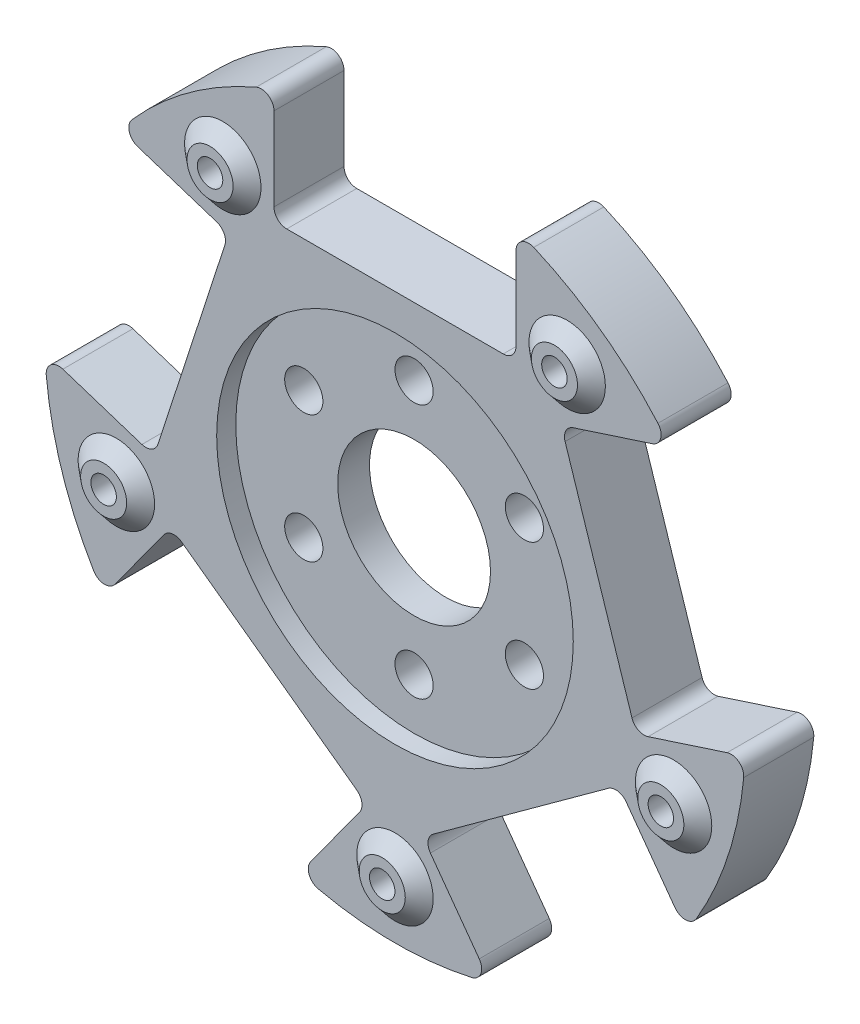
from build123d import *

# Parameters (mm, degrees)
SKETCH2_R                     = 14
BOSS_EXTRUDE1_DEPTH           = 2.75
SKETCH2_3_R                   = 14
SKETCH2_3_R_2                 = 1.5
SKETCH2_3_R_3                 = 6
BOSS_EXTRUDE2_DEPTH           = 1.25
FILLET1_R                     = 1
SKETCH3_R                     = 3
BOSS_EXTRUDE3_DEPTH           = 1
BOSS_EXTRUDE3_DRAFT           = 50
BOSS_EXTRUDE3_PROFILE_2_DEPTH = 1
BOSS_EXTRUDE3_PROFILE_2_DRAFT = 50
BOSS_EXTRUDE3_PROFILE_3_DEPTH = 1
BOSS_EXTRUDE3_PROFILE_3_DRAFT = 50
BOSS_EXTRUDE3_PROFILE_4_DEPTH = 1
BOSS_EXTRUDE3_PROFILE_4_DRAFT = 50
BOSS_EXTRUDE3_PROFILE_5_DEPTH = 1
BOSS_EXTRUDE3_PROFILE_5_DRAFT = 50
SKETCH4_R                     = 1
CUT_EXTRUDE1_DEPTH            = 2
SKETCH5_R                     = 3
BOSS_EXTRUDE5_DEPTH           = 1
BOSS_EXTRUDE5_DRAFT           = 50
BOSS_EXTRUDE5_PROFILE_2_DEPTH = 1
BOSS_EXTRUDE5_PROFILE_2_DRAFT = 50
BOSS_EXTRUDE5_PROFILE_3_DEPTH = 1
BOSS_EXTRUDE5_PROFILE_3_DRAFT = 50
BOSS_EXTRUDE5_PROFILE_4_DEPTH = 1
BOSS_EXTRUDE5_PROFILE_4_DRAFT = 50
BOSS_EXTRUDE5_PROFILE_5_DEPTH = 1
BOSS_EXTRUDE5_PROFILE_5_DRAFT = 50
CUT_EXTRUDE2_START            = -1
SKETCH6_R                     = 1
CUT_EXTRUDE2_DEPTH            = 1


with BuildPart() as part:
    # Sketch2 → Boss-Extrude1 (new, symmetric)
    with BuildSketch(Plane.XY):
        with BuildLine():
            Line((-9.5, 16.806975801), (-9.5, 25.806975801))
            ThreePointArc((-9.5, 25.806975801), (-16.164094438, 22.247967345), (-21.608231055, 17.009831001))
            Line((-21.608231055, 17.009831001), (-13.048722408, 14.228678051))
            Line((-13.048722408, 14.228678051), (-18.920045301, -3.841395758))
            Line((-18.920045301, -3.841395758), (-27.479553948, -1.060242809))
            ThreePointArc((-27.479553948, -1.060242809), (-26.154054198, -8.497967345), (-22.854621229, -15.2943221))
            Line((-22.854621229, -15.2943221), (-17.564553958, -8.01316915))
            Line((-17.564553958, -8.01316915), (-2.193231065, -19.181088944))
            Line((-2.193231065, -19.181088944), (-7.483298336, -26.462241893))
            ThreePointArc((-7.483298336, -26.462241893), (0, -27.5), (7.483298336, -26.462241893))
            Line((7.483298336, -26.462241893), (2.193231065, -19.181088944))
            Line((2.193231065, -19.181088944), (17.564553958, -8.01316915))
            Line((17.564553958, -8.01316915), (22.854621229, -15.2943221))
            ThreePointArc((22.854621229, -15.2943221), (26.154054198, -8.497967345), (27.479553948, -1.060242809))
            Line((27.479553948, -1.060242809), (18.920045301, -3.841395758))
            Line((18.920045301, -3.841395758), (13.048722408, 14.228678051))
            Line((13.048722408, 14.228678051), (21.608231055, 17.009831001))
            ThreePointArc((21.608231055, 17.009831001), (16.164094438, 22.247967345), (9.5, 25.806975801))
            Line((9.5, 25.806975801), (9.5, 16.806975801))
            Line((9.5, 16.806975801), (-9.5, 16.806975801))
        make_face()
        Circle(SKETCH2_R, mode=Mode.SUBTRACT)
    extrude(amount=BOSS_EXTRUDE1_DEPTH, both=True)

    # Sketch2<3> → Boss-Extrude2 (add, symmetric)
    with BuildSketch(Plane.XY):
        Circle(SKETCH2_3_R)
        with Locations((0, -10)):
            Circle(SKETCH2_3_R_2, mode=Mode.SUBTRACT)
        with Locations((-8.660254038, -5)):
            Circle(SKETCH2_3_R_2, mode=Mode.SUBTRACT)
        with Locations((8.660254038, -5)):
            Circle(SKETCH2_3_R_2, mode=Mode.SUBTRACT)
        with Locations((-8.660254038, 5)):
            Circle(SKETCH2_3_R_2, mode=Mode.SUBTRACT)
        Circle(SKETCH2_3_R_3, mode=Mode.SUBTRACT)
        with Locations((8.660254038, 5)):
            Circle(SKETCH2_3_R_2, mode=Mode.SUBTRACT)
        with Locations((0, 10)):
            Circle(SKETCH2_3_R_2, mode=Mode.SUBTRACT)
    extrude(amount=BOSS_EXTRUDE2_DEPTH, both=True)

    # Fillet1
    fillet1_edges = [part.edges().sort_by_distance(p)[0] for p in [
        (-18.920045301, -3.841395758, 0),
        (-13.048722408, 14.228678051, 0),
        (-21.608231055, 17.009831001, 0),
        (-9.5, 25.806975801, 0),
        (-9.5, 16.806975801, 0),
        (9.5, 16.806975801, 0),
        (9.5, 25.806975801, 0),
        (21.608231055, 17.009831001, 0),
        (13.048722408, 14.228678051, 0),
        (18.920045301, -3.841395758, 0),
        (27.479553948, -1.060242809, 0),
        (22.854621229, -15.2943221, 0),
        (17.564553958, -8.01316915, 0),
        (2.193231065, -19.181088944, 0),
        (7.483298336, -26.462241893, 0),
        (-7.483298336, -26.462241893, 0),
        (-2.193231065, -19.181088944, 0),
        (-17.564553958, -8.01316915, 0),
        (-22.854621229, -15.2943221, 0),
        (-27.479553948, -1.060242809, 0),
    ]]
    fillet(fillet1_edges, radius=FILLET1_R)


with BuildPart() as boss_extrude3_tool:
    # Sketch3 → Boss-Extrude3 (with draft: the straight prism first)
    with BuildSketch(Plane.XY.offset(2.75)):
        with Locations((13.519060803, 18.607390871)):
            Circle(SKETCH3_R)
    extrude(amount=BOSS_EXTRUDE3_DEPTH)
    # Boss-Extrude3: the draft: its side faces are tilted about the plane it starts from
    boss_extrude3_sides = [boss_extrude3_tool.faces().sort_by_distance(p)[0] for p in [
        (10.519060803, 18.607390871, 3.25),
    ]]
    draft(boss_extrude3_sides, Plane.XY.offset(2.75), BOSS_EXTRUDE3_DRAFT)


with BuildPart() as part_1:
    add(part.part)

    # Boss-Extrude3: add boss_extrude3_tool
    add(boss_extrude3_tool.part)


with BuildPart() as boss_extrude3_profile_2_tool:
    # Sketch3 → Boss-Extrude3 profile 2 (with draft: the straight prism first)
    with BuildSketch(Plane.XY.offset(2.75)):
        with Locations((21.874299875, -7.107390871)):
            Circle(SKETCH3_R)
    extrude(amount=BOSS_EXTRUDE3_PROFILE_2_DEPTH)
    # Boss-Extrude3 profile 2: the draft: its side faces are tilted about the plane it starts from
    boss_extrude3_profile_2_sides = [boss_extrude3_profile_2_tool.faces().sort_by_distance(p)[0] for p in [
        (18.874299875, -7.107390871, 3.25),
    ]]
    draft(boss_extrude3_profile_2_sides, Plane.XY.offset(2.75), BOSS_EXTRUDE3_PROFILE_2_DRAFT)


with BuildPart() as part_2:
    add(part_1.part)

    # Boss-Extrude3 profile 2: add boss_extrude3_profile_2_tool
    add(boss_extrude3_profile_2_tool.part)


with BuildPart() as boss_extrude3_profile_3_tool:
    # Sketch3 → Boss-Extrude3 profile 3 (with draft: the straight prism first)
    with BuildSketch(Plane.XY.offset(2.75)):
        with Locations((0, -23)):
            Circle(SKETCH3_R)
    extrude(amount=BOSS_EXTRUDE3_PROFILE_3_DEPTH)
    # Boss-Extrude3 profile 3: the draft: its side faces are tilted about the plane it starts from
    boss_extrude3_profile_3_sides = [boss_extrude3_profile_3_tool.faces().sort_by_distance(p)[0] for p in [
        (-3, -23, 3.25),
    ]]
    draft(boss_extrude3_profile_3_sides, Plane.XY.offset(2.75), BOSS_EXTRUDE3_PROFILE_3_DRAFT)


with BuildPart() as part_3:
    add(part_2.part)

    # Boss-Extrude3 profile 3: add boss_extrude3_profile_3_tool
    add(boss_extrude3_profile_3_tool.part)


with BuildPart() as boss_extrude3_profile_4_tool:
    # Sketch3 → Boss-Extrude3 profile 4 (with draft: the straight prism first)
    with BuildSketch(Plane.XY.offset(2.75)):
        with Locations((-21.874299875, -7.107390871)):
            Circle(SKETCH3_R)
    extrude(amount=BOSS_EXTRUDE3_PROFILE_4_DEPTH)
    # Boss-Extrude3 profile 4: the draft: its side faces are tilted about the plane it starts from
    boss_extrude3_profile_4_sides = [boss_extrude3_profile_4_tool.faces().sort_by_distance(p)[0] for p in [
        (-24.874299875, -7.107390871, 3.25),
    ]]
    draft(boss_extrude3_profile_4_sides, Plane.XY.offset(2.75), BOSS_EXTRUDE3_PROFILE_4_DRAFT)


with BuildPart() as part_4:
    add(part_3.part)

    # Boss-Extrude3 profile 4: add boss_extrude3_profile_4_tool
    add(boss_extrude3_profile_4_tool.part)


with BuildPart() as boss_extrude3_profile_5_tool:
    # Sketch3 → Boss-Extrude3 profile 5 (with draft: the straight prism first)
    with BuildSketch(Plane.XY.offset(2.75)):
        with Locations((-13.519060803, 18.607390871)):
            Circle(SKETCH3_R)
    extrude(amount=BOSS_EXTRUDE3_PROFILE_5_DEPTH)
    # Boss-Extrude3 profile 5: the draft: its side faces are tilted about the plane it starts from
    boss_extrude3_profile_5_sides = [boss_extrude3_profile_5_tool.faces().sort_by_distance(p)[0] for p in [
        (-16.519060803, 18.607390871, 3.25),
    ]]
    draft(boss_extrude3_profile_5_sides, Plane.XY.offset(2.75), BOSS_EXTRUDE3_PROFILE_5_DRAFT)


with BuildPart() as part_5:
    add(part_4.part)

    # Boss-Extrude3 profile 5: add boss_extrude3_profile_5_tool
    add(boss_extrude3_profile_5_tool.part)

    # Sketch4 → Cut-Extrude1 (cut)
    with BuildSketch(Plane.XY.offset(3.75)):
        with Locations((13.519060803, 18.607390871)):
            Circle(SKETCH4_R)
        with Locations((21.874299875, -7.107390871)):
            Circle(SKETCH4_R)
        with Locations((0, -23)):
            Circle(SKETCH4_R)
        with Locations((-21.874299875, -7.107390871)):
            Circle(SKETCH4_R)
        with Locations((-13.519060803, 18.607390871)):
            Circle(SKETCH4_R)
    extrude(amount=-CUT_EXTRUDE1_DEPTH, mode=Mode.SUBTRACT)


with BuildPart() as boss_extrude5_tool:
    # Sketch5 → Boss-Extrude5 (with draft: the straight prism first)
    with BuildSketch(Plane(origin=(0, 0, -2.75), x_dir=(-1, 0, 0), z_dir=(0, 0, -1))):
        with Locations((13.519060803, 18.607390871)):
            Circle(SKETCH5_R)
    extrude(amount=BOSS_EXTRUDE5_DEPTH)
    # Boss-Extrude5: the draft: its side faces are tilted about the plane it starts from
    boss_extrude5_sides = [boss_extrude5_tool.faces().sort_by_distance(p)[0] for p in [
        (-10.519060803, 18.607390871, -3.25),
    ]]
    draft(boss_extrude5_sides, Plane(origin=(0, 0, -2.75), x_dir=(-1, 0, 0), z_dir=(0, 0, -1)), BOSS_EXTRUDE5_DRAFT)


with BuildPart() as part_6:
    add(part_5.part)

    # Boss-Extrude5: add boss_extrude5_tool
    add(boss_extrude5_tool.part)


with BuildPart() as boss_extrude5_profile_2_tool:
    # Sketch5 → Boss-Extrude5 profile 2 (with draft: the straight prism first)
    with BuildSketch(Plane(origin=(0, 0, -2.75), x_dir=(-1, 0, 0), z_dir=(0, 0, -1))):
        with Locations((21.874299875, -7.107390871)):
            Circle(SKETCH5_R)
    extrude(amount=BOSS_EXTRUDE5_PROFILE_2_DEPTH)
    # Boss-Extrude5 profile 2: the draft: its side faces are tilted about the plane it starts from
    boss_extrude5_profile_2_sides = [boss_extrude5_profile_2_tool.faces().sort_by_distance(p)[0] for p in [
        (-18.874299875, -7.107390871, -3.25),
    ]]
    draft(boss_extrude5_profile_2_sides, Plane(origin=(0, 0, -2.75), x_dir=(-1, 0, 0), z_dir=(0, 0, -1)), BOSS_EXTRUDE5_PROFILE_2_DRAFT)


with BuildPart() as part_7:
    add(part_6.part)

    # Boss-Extrude5 profile 2: add boss_extrude5_profile_2_tool
    add(boss_extrude5_profile_2_tool.part)


with BuildPart() as boss_extrude5_profile_3_tool:
    # Sketch5 → Boss-Extrude5 profile 3 (with draft: the straight prism first)
    with BuildSketch(Plane(origin=(0, 0, -2.75), x_dir=(-1, 0, 0), z_dir=(0, 0, -1))):
        with Locations((0, -23)):
            Circle(SKETCH5_R)
    extrude(amount=BOSS_EXTRUDE5_PROFILE_3_DEPTH)
    # Boss-Extrude5 profile 3: the draft: its side faces are tilted about the plane it starts from
    boss_extrude5_profile_3_sides = [boss_extrude5_profile_3_tool.faces().sort_by_distance(p)[0] for p in [
        (3, -23, -3.25),
    ]]
    draft(boss_extrude5_profile_3_sides, Plane(origin=(0, 0, -2.75), x_dir=(-1, 0, 0), z_dir=(0, 0, -1)), BOSS_EXTRUDE5_PROFILE_3_DRAFT)


with BuildPart() as part_8:
    add(part_7.part)

    # Boss-Extrude5 profile 3: add boss_extrude5_profile_3_tool
    add(boss_extrude5_profile_3_tool.part)


with BuildPart() as boss_extrude5_profile_4_tool:
    # Sketch5 → Boss-Extrude5 profile 4 (with draft: the straight prism first)
    with BuildSketch(Plane(origin=(0, 0, -2.75), x_dir=(-1, 0, 0), z_dir=(0, 0, -1))):
        with Locations((-21.874299875, -7.107390871)):
            Circle(SKETCH5_R)
    extrude(amount=BOSS_EXTRUDE5_PROFILE_4_DEPTH)
    # Boss-Extrude5 profile 4: the draft: its side faces are tilted about the plane it starts from
    boss_extrude5_profile_4_sides = [boss_extrude5_profile_4_tool.faces().sort_by_distance(p)[0] for p in [
        (24.874299875, -7.107390871, -3.25),
    ]]
    draft(boss_extrude5_profile_4_sides, Plane(origin=(0, 0, -2.75), x_dir=(-1, 0, 0), z_dir=(0, 0, -1)), BOSS_EXTRUDE5_PROFILE_4_DRAFT)


with BuildPart() as part_9:
    add(part_8.part)

    # Boss-Extrude5 profile 4: add boss_extrude5_profile_4_tool
    add(boss_extrude5_profile_4_tool.part)


with BuildPart() as boss_extrude5_profile_5_tool:
    # Sketch5 → Boss-Extrude5 profile 5 (with draft: the straight prism first)
    with BuildSketch(Plane(origin=(0, 0, -2.75), x_dir=(-1, 0, 0), z_dir=(0, 0, -1))):
        with Locations((-13.519060803, 18.607390871)):
            Circle(SKETCH5_R)
    extrude(amount=BOSS_EXTRUDE5_PROFILE_5_DEPTH)
    # Boss-Extrude5 profile 5: the draft: its side faces are tilted about the plane it starts from
    boss_extrude5_profile_5_sides = [boss_extrude5_profile_5_tool.faces().sort_by_distance(p)[0] for p in [
        (16.519060803, 18.607390871, -3.25),
    ]]
    draft(boss_extrude5_profile_5_sides, Plane(origin=(0, 0, -2.75), x_dir=(-1, 0, 0), z_dir=(0, 0, -1)), BOSS_EXTRUDE5_PROFILE_5_DRAFT)


with BuildPart() as part_10:
    add(part_9.part)

    # Boss-Extrude5 profile 5: add boss_extrude5_profile_5_tool
    add(boss_extrude5_profile_5_tool.part)

    # Sketch6 → Cut-Extrude2 (cut)
    with BuildSketch(Plane(origin=(0, 0, -3.75), x_dir=(-1, 0, 0), z_dir=(0, 0, -1)).offset(CUT_EXTRUDE2_START)):
        with Locations(Location((13.519060803, 18.607390871, 0), (0, 0, 180))):
            Circle(SKETCH6_R)
        with Locations(Location((21.874299875, -7.107390871, 0), (0, 0, 180))):
            Circle(SKETCH6_R)
        with Locations(Location((0, -23, 0), (0, 0, 180))):
            Circle(SKETCH6_R)
        with Locations(Location((-21.874299875, -7.107390871, 0), (0, 0, 180))):
            Circle(SKETCH6_R)
        with Locations(Location((-13.519060803, 18.607390871, 0), (0, 0, 180))):
            Circle(SKETCH6_R)
    extrude(amount=CUT_EXTRUDE2_DEPTH, mode=Mode.SUBTRACT)


solid = part_10.part
